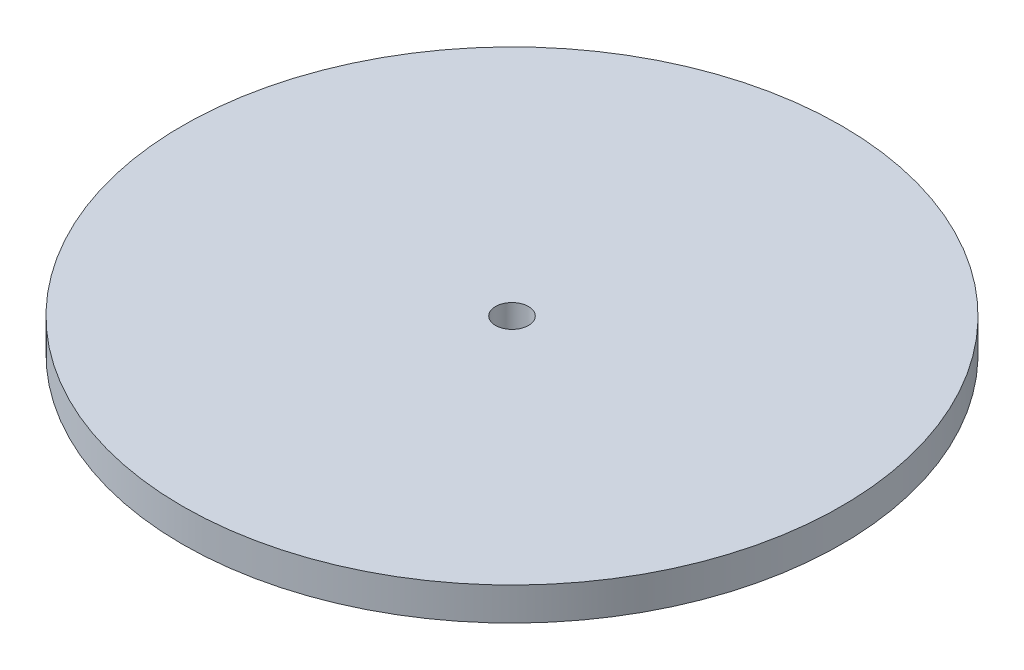
from build123d import *

# Parameters (mm, degrees)
SKETCH1_R           = 101.6
BOSS_EXTRUDE1_DEPTH = 10.16
SKETCH2_R           = 5.08
CUT_EXTRUDE1_DEPTH  = 10.16


with BuildPart() as part:
    # Sketch1 → Boss-Extrude1 (new body)
    with BuildSketch(Plane(origin=(0, 0, 0), x_dir=(1, 0, 0), z_dir=(0, 1, 0))):
        with Locations(Location((0, 0, 0), (0, 0, 270))):
            Circle(SKETCH1_R)
    extrude(amount=BOSS_EXTRUDE1_DEPTH)

    # Sketch2 → Cut-Extrude1 (cut)
    with BuildSketch(Plane(origin=(0, 10.16, 0), x_dir=(1, 0, 0), z_dir=(0, 1, 0))):
        with Locations(Location((0, 0, 0), (0, 0, 270))):
            Circle(SKETCH2_R)
    extrude(amount=-CUT_EXTRUDE1_DEPTH, mode=Mode.SUBTRACT)


solid = part.part
